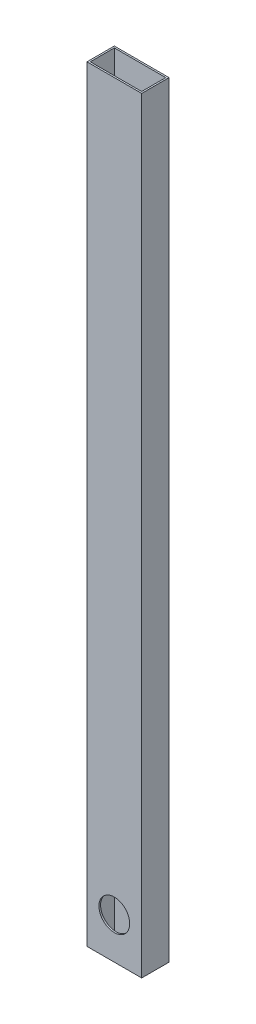
from build123d import *

# Parameters (mm, degrees)
SKETCH1_W               = 50.8
SKETCH1_H               = 25.4
SKETCH1_W_2             = 47.752
SKETCH1_H_2             = 22.352
EXTRUDE_THIN1_DEPTH     = 711.2
CUT_EXTRUDE1_DEPTH      = 714.464252784
CUT_EXTRUDE1_DEPTH_BACK = 714.464252784
SKETCH2_R               = 14.2875


with BuildPart() as part:
    # Sketch1 → Extrude-Thin1 (new body)
    with BuildSketch(Plane(origin=(0, 0, 0), x_dir=(1, 0, 0), z_dir=(0, 1, 0))):
        with Locations((-25.4, -12.7)):
            Rectangle(SKETCH1_W, SKETCH1_H)
        with Locations((-25.4, -12.7)):
            Rectangle(SKETCH1_W_2, SKETCH1_H_2, mode=Mode.SUBTRACT)
    extrude(amount=EXTRUDE_THIN1_DEPTH)

    # Sketch2 → Cut-Extrude1 (cut, two sides: drawn at the far end of the back side and taken through both)
    with BuildSketch(Plane.XY.offset(25.4).offset(-CUT_EXTRUDE1_DEPTH_BACK)):
        with Locations(Location((-25.4, 38.1, 0), (0, 0, 180))):
            Circle(SKETCH2_R)
    extrude(amount=CUT_EXTRUDE1_DEPTH + CUT_EXTRUDE1_DEPTH_BACK, mode=Mode.SUBTRACT)


solid = part.part
